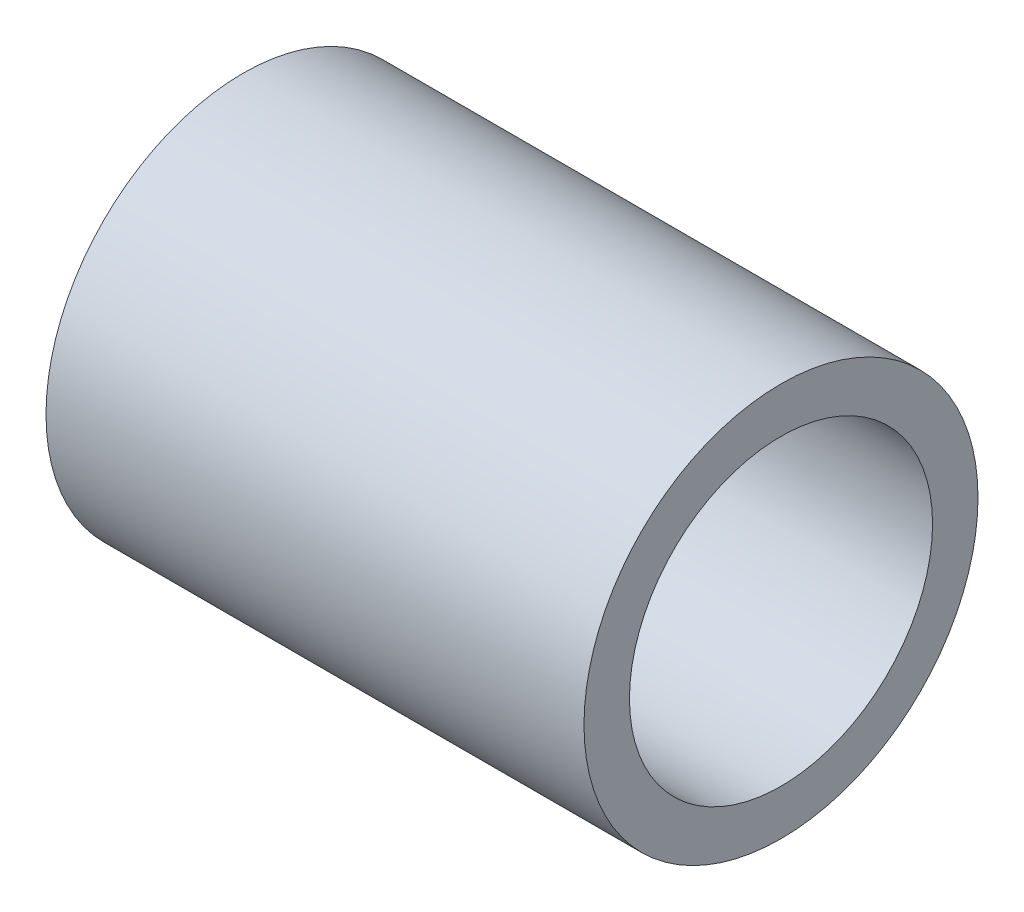
from build123d import *

# Parameters (mm, degrees)
SKETCH_1_W = 35.5
SKETCH_1_H = 3


with BuildPart() as part:
    # Эскиз1 → Повернуть1 (revolve)
    with BuildSketch(Plane.XY, mode=Mode.PRIVATE) as revolve_1_sk:
        with Locations((0, 11.5)):
            Rectangle(SKETCH_1_W, SKETCH_1_H)
    revolve(revolve_1_sk.sketch.rotate(Axis((0, 0, 0), (1, 0, 0)), 90), axis=Axis((0, 0, 0), (1, 0, 0)))


solid = part.part
